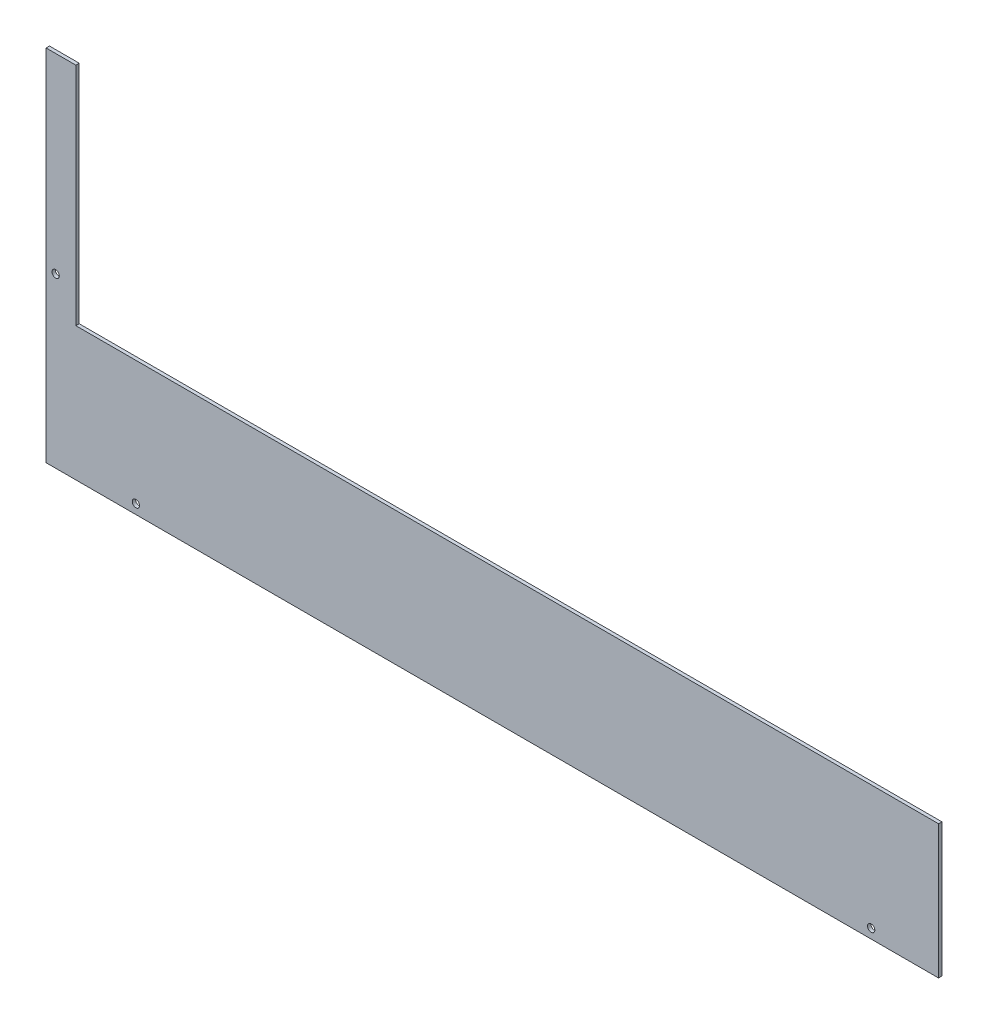
from build123d import *

# Parameters (mm, degrees)
SKETCH_1_R      = 3.25
EXTRUDE_1_DEPTH = 3


with BuildPart() as part:
    # 스케치1 → 보스-돌출1 (new body)
    with BuildSketch(Plane.XY):
        Polygon((0, 0), (26.5, 0), (26.5, -201), (795, -201), (795, -320), (0, -320), align=None)
        with Locations((735, -311.5)):
            Circle(SKETCH_1_R, mode=Mode.SUBTRACT)
        with Locations((80, -311.5)):
            Circle(SKETCH_1_R, mode=Mode.SUBTRACT)
        with Locations((8.5, -170)):
            Circle(SKETCH_1_R, mode=Mode.SUBTRACT)
    extrude(amount=EXTRUDE_1_DEPTH)


solid = part.part
